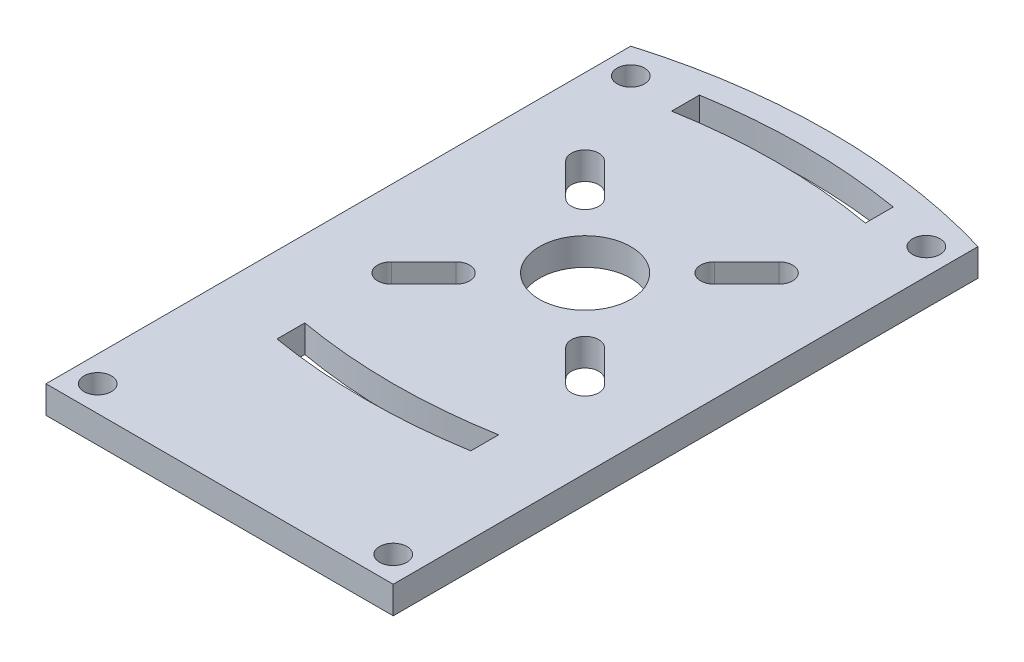
from build123d import *

# Parameters (mm, degrees)
SKETCH_1_R      = 5
SKETCH_1_R_2    = 1.5
EXTRUDE_2_DEPTH = 3


with BuildPart() as part:
    # 草图1 → 凸台-拉伸2 (new body)
    with BuildSketch(Plane(origin=(0, 0, 0), x_dir=(1, 0, 0), z_dir=(0, 1, 0))):
        with BuildLine():
            Line((0, 0), (19, 0))
            Line((19, 0), (19, 64))
            ThreePointArc((19, 64), (0, 66.760766922), (-19, 64))
            Line((-19, 64), (-19, 0))
            Line((-19, 0), (0, 0))
        make_face()
        with Locations(Location((0, 40, 0), (0, 0, 270))):
            Circle(SKETCH_1_R, mode=Mode.SUBTRACT)
        with Locations(Location((-16.171572875, 2.828427125, 0), (0, 0, 270))):
            Circle(SKETCH_1_R_2, mode=Mode.SUBTRACT)
        with Locations(Location((-16.171572875, 61.171572875, 0), (0, 0, 270))):
            Circle(SKETCH_1_R_2, mode=Mode.SUBTRACT)
        with Locations(Location((16.171572875, 61.171572875, 0), (0, 0, 90))):
            Circle(SKETCH_1_R_2, mode=Mode.SUBTRACT)
        with Locations(Location((16.171572875, 2.828427125, 0), (0, 0, 90))):
            Circle(SKETCH_1_R_2, mode=Mode.SUBTRACT)
        with BuildLine():
            Line((10.606601718, 19.929208429), (10.606601718, 16.885025549))
            ThreePointArc((10.606601718, 16.885025549), (0, 16), (-10.606601718, 16.885025549))
            Line((-10.606601718, 16.885025549), (-10.606601718, 19.929208429))
            ThreePointArc((-10.606601718, 19.929208429), (0, 19), (10.606601718, 19.929208429))
        make_face(mode=Mode.SUBTRACT)
        with BuildLine():
            Line((-8.131727984, 46.01040764), (-11.66726189, 49.545941546))
            ThreePointArc((-11.66726189, 49.545941546), (-11.66726189, 51.66726189), (-9.545941546, 51.66726189))
            Line((-9.545941546, 51.66726189), (-6.01040764, 48.131727984))
            ThreePointArc((-6.01040764, 48.131727984), (-6.01040764, 46.01040764), (-8.131727984, 46.01040764))
        make_face(mode=Mode.SUBTRACT)
        with BuildLine():
            Line((6.01040764, 48.131727984), (9.545941546, 51.66726189))
            ThreePointArc((9.545941546, 51.66726189), (11.66726189, 51.66726189), (11.66726189, 49.545941546))
            Line((11.66726189, 49.545941546), (8.131727984, 46.01040764))
            ThreePointArc((8.131727984, 46.01040764), (6.01040764, 46.01040764), (6.01040764, 48.131727984))
        make_face(mode=Mode.SUBTRACT)
        with BuildLine():
            Line((8.131727984, 33.98959236), (11.66726189, 30.454058454))
            ThreePointArc((11.66726189, 30.454058454), (11.66726189, 28.33273811), (9.545941546, 28.33273811))
            Line((9.545941546, 28.33273811), (6.01040764, 31.868272016))
            ThreePointArc((6.01040764, 31.868272016), (6.01040764, 33.98959236), (8.131727984, 33.98959236))
        make_face(mode=Mode.SUBTRACT)
        with BuildLine():
            Line((-6.01040764, 31.868272016), (-9.545941546, 28.33273811))
            ThreePointArc((-9.545941546, 28.33273811), (-11.66726189, 28.33273811), (-11.66726189, 30.454058454))
            Line((-11.66726189, 30.454058454), (-8.131727984, 33.98959236))
            ThreePointArc((-8.131727984, 33.98959236), (-6.01040764, 33.98959236), (-6.01040764, 31.868272016))
        make_face(mode=Mode.SUBTRACT)
        with BuildLine():
            Line((-10.606601718, 60.070791571), (-10.606601718, 63.114974451))
            ThreePointArc((-10.606601718, 63.114974451), (0, 64), (10.606601718, 63.114974451))
            Line((10.606601718, 63.114974451), (10.606601718, 60.070791571))
            ThreePointArc((10.606601718, 60.070791571), (0, 61), (-10.606601718, 60.070791571))
        make_face(mode=Mode.SUBTRACT)
    extrude(amount=EXTRUDE_2_DEPTH)


solid = part.part
